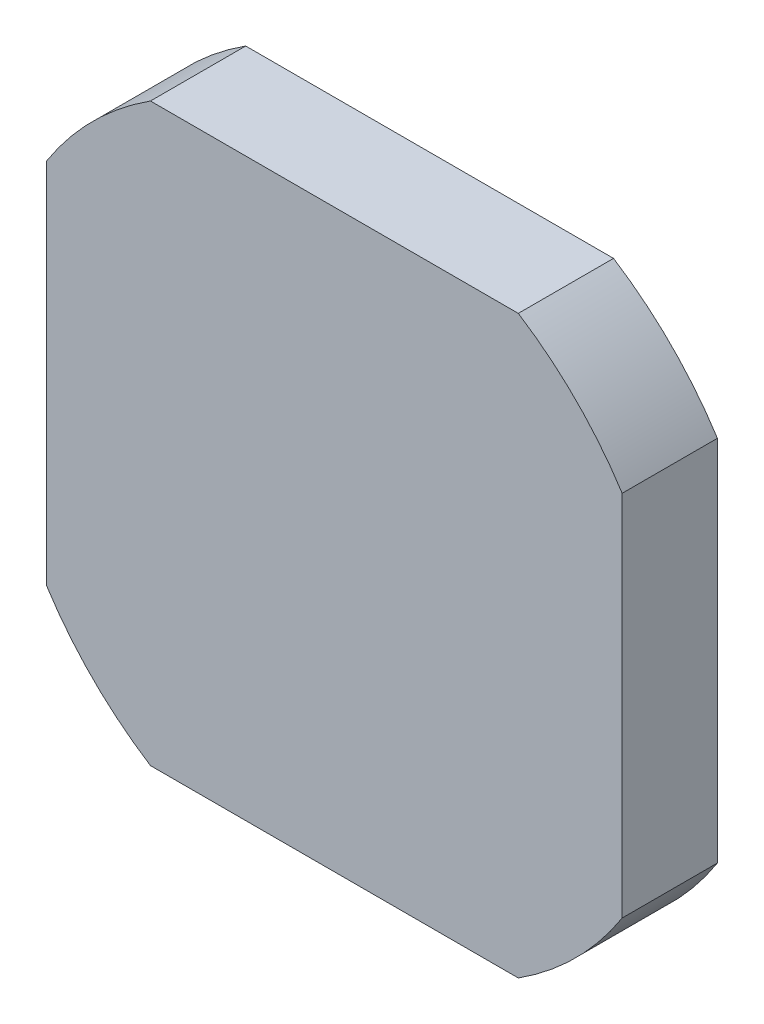
from build123d import *

# Parameters (mm, degrees)
SALIENTE_EXTRUIR1_DEPTH = 7
SKETCH_1_OUTSIDE_W      = 56.346
SKETCH_1_OUTSIDE_H      = 56.346
SKETCH_1_OUTSIDE_R      = 25.1
CUT_EXTRUDE_1_DEPTH     = 31.718805315


with BuildPart() as part:
    # Croquis1 → Saliente-Extruir1 (new body)
    with BuildSketch(Plane.XY):
        Polygon((-17.15, 21.15), (-21.15, 17.15), (-21.15, -17.15), (-17.15, -21.15), (17.15, -21.15), (21.15, -17.15), (21.15, 17.15), (17.15, 21.15), align=None)
    extrude(amount=SALIENTE_EXTRUIR1_DEPTH)

    # Эскиз1 outside → Вырез-Вытянуть1 (cut, through all)
    with BuildSketch(Plane.XY.offset(7)):
        Rectangle(SKETCH_1_OUTSIDE_W, SKETCH_1_OUTSIDE_H)
        Circle(SKETCH_1_OUTSIDE_R, mode=Mode.SUBTRACT)
    extrude(amount=-CUT_EXTRUDE_1_DEPTH, mode=Mode.SUBTRACT)


solid = part.part
